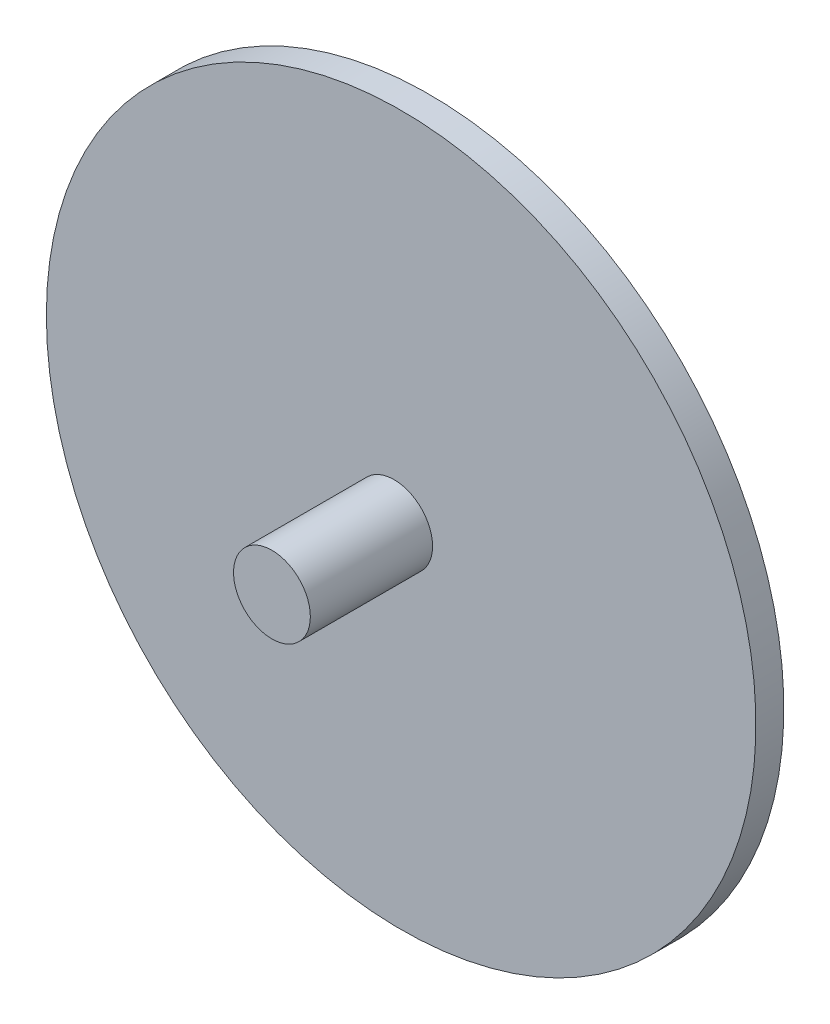
from build123d import *

# Parameters (mm, degrees)
SKETCH_1_R      = 11
EXTRUDE_1_DEPTH = 35
SKETCH_2_R      = 3
EXTRUDE_2_DEPTH = 10
SKETCH_3_R      = 101.6
EXTRUDE_3_DEPTH = 8


with BuildPart() as part:
    # 草图1 → 拉伸1 (new body)
    with BuildSketch(Plane.XY):
        Circle(SKETCH_1_R)
    extrude(amount=EXTRUDE_1_DEPTH)

    # 草图2 → 拉伸2 (add)
    with BuildSketch(Plane(origin=(0, 0, 0), x_dir=(-1, 0, 0), z_dir=(0, 0, -1))):
        with Locations(Location((0, 0, 0), (0, 0, 180))):
            Circle(SKETCH_2_R)
    extrude(amount=EXTRUDE_2_DEPTH)


with BuildPart() as body_2:
    # 草图3 → 拉伸3 (new body)
    with BuildSketch(Plane(origin=(0, 0, -10), x_dir=(-1, 0, 0), z_dir=(0, 0, -1))):
        Circle(SKETCH_3_R)
    extrude(amount=-EXTRUDE_3_DEPTH)


solid = Compound([part.part, body_2.part])
